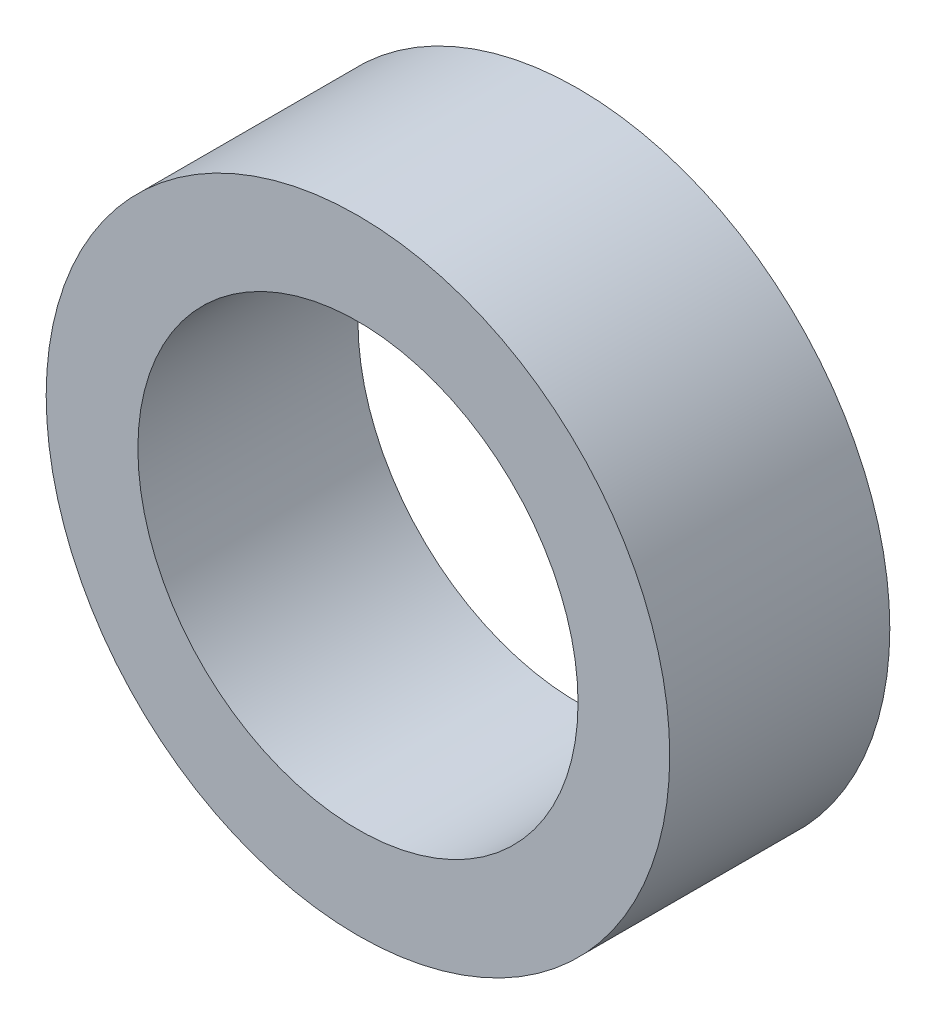
from build123d import *

# Parameters (mm, degrees)
SKETCH1_R           = 17
SKETCH1_R_2         = 12
BOSS_EXTRUDE1_DEPTH = 12


with BuildPart() as part:
    # Sketch1 → Boss-Extrude1 (new body)
    with BuildSketch(Plane.XY):
        Circle(SKETCH1_R)
        Circle(SKETCH1_R_2, mode=Mode.SUBTRACT)
    extrude(amount=-BOSS_EXTRUDE1_DEPTH)


solid = part.part
